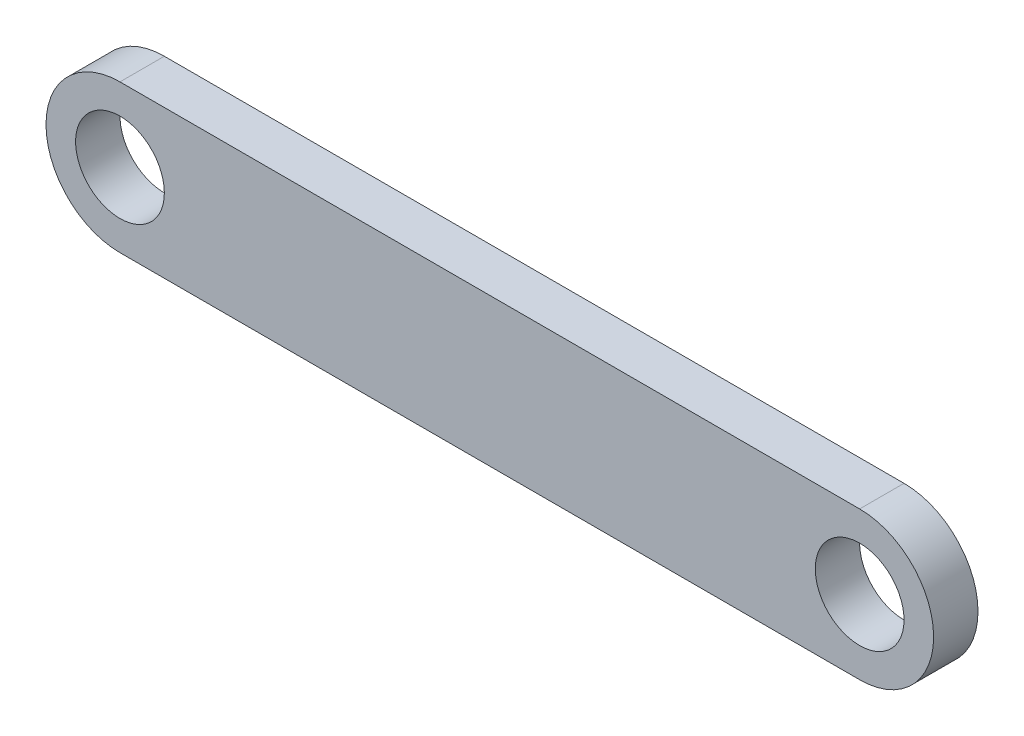
from build123d import *

# Parameters (mm, degrees)
SKETCH_1_R      = 3
EXTRUDE_1_DEPTH = 3


with BuildPart() as part:
    # ｽｹｯﾁ1 → ﾎﾞｽ - 押し出し1 (new body)
    with BuildSketch(Plane.XY):
        with BuildLine():
            Line((-25, 5), (25, 5))
            ThreePointArc((25, 5), (30, 0), (25, -5))
            Line((25, -5), (-25, -5))
            ThreePointArc((-25, -5), (-30, 0), (-25, 5))
        make_face()
        with Locations((-25, 0)):
            Circle(SKETCH_1_R, mode=Mode.SUBTRACT)
        with Locations((25, 0)):
            Circle(SKETCH_1_R, mode=Mode.SUBTRACT)
    extrude(amount=EXTRUDE_1_DEPTH)


solid = part.part
